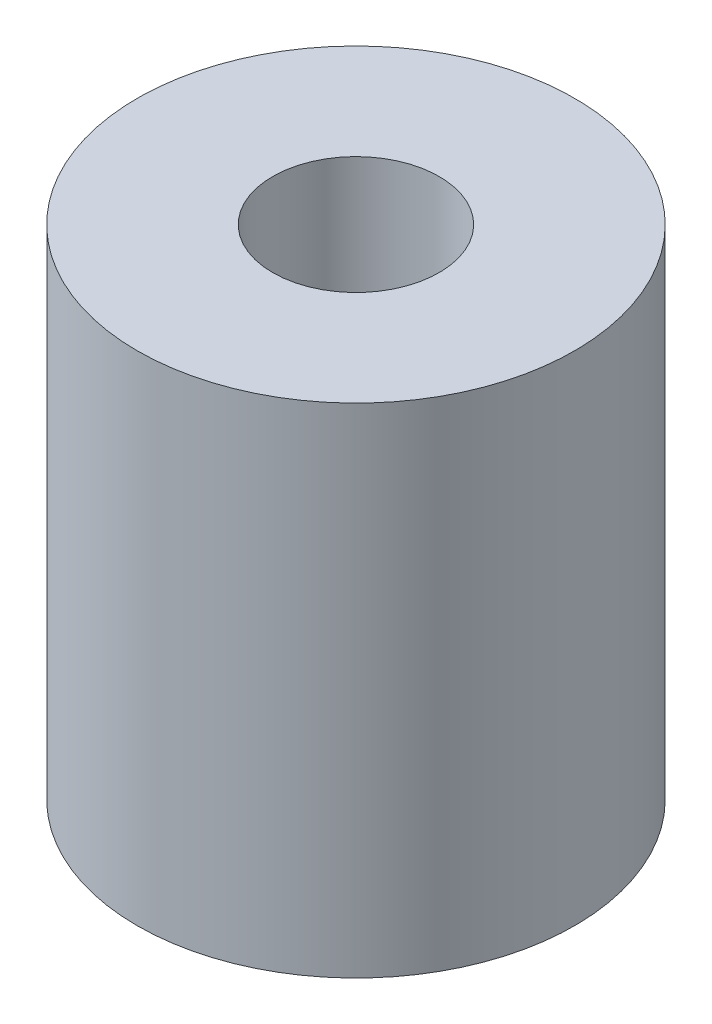
from build123d import *

# Parameters (mm, degrees)
SKETCH1_R           = 13
SKETCH1_R_2         = 4.95
BOSS_EXTRUDE1_DEPTH = 29.6
BOSS_EXTRUDE3_START = -8.650573
SKETCH2_R           = 4.95
BOSS_EXTRUDE3_DEPTH = 8.650573
SKETCH3_R           = 4.95
SKETCH3_R_2         = 3.9
BOSS_EXTRUDE4_DEPTH = 11.85


with BuildPart() as part:
    # Sketch1 → Boss-Extrude1 (new body)
    with BuildSketch(Plane(origin=(0, 0, 0), x_dir=(1, 0, 0), z_dir=(0, 1, 0))):
        with Locations(Location((0, 0, 0), (0, 0, 270))):
            Circle(SKETCH1_R)
        with Locations(Location((0, 0, 0), (0, 0, 270))):
            Circle(SKETCH1_R_2, mode=Mode.SUBTRACT)
    extrude(amount=BOSS_EXTRUDE1_DEPTH)

    # Sketch2 → Boss-Extrude3 (add)
    with BuildSketch(Plane(origin=(0, 18.650573, 0), x_dir=(1, 0, 0), z_dir=(0, 1, 0)).offset(BOSS_EXTRUDE3_START)):
        with Locations(Location((0, 0, 0), (0, 0, 270))):
            Circle(SKETCH2_R)
    extrude(amount=BOSS_EXTRUDE3_DEPTH)

    # Sketch3 → Boss-Extrude4 (add)
    with BuildSketch(Plane.XZ):
        with Locations(Location((0, 0, 0), (0, 0, 90))):
            Circle(SKETCH3_R)
        with Locations(Location((0, 0, 0), (0, 0, 270))):
            Circle(SKETCH3_R_2, mode=Mode.SUBTRACT)
    extrude(amount=-BOSS_EXTRUDE4_DEPTH)


solid = part.part
